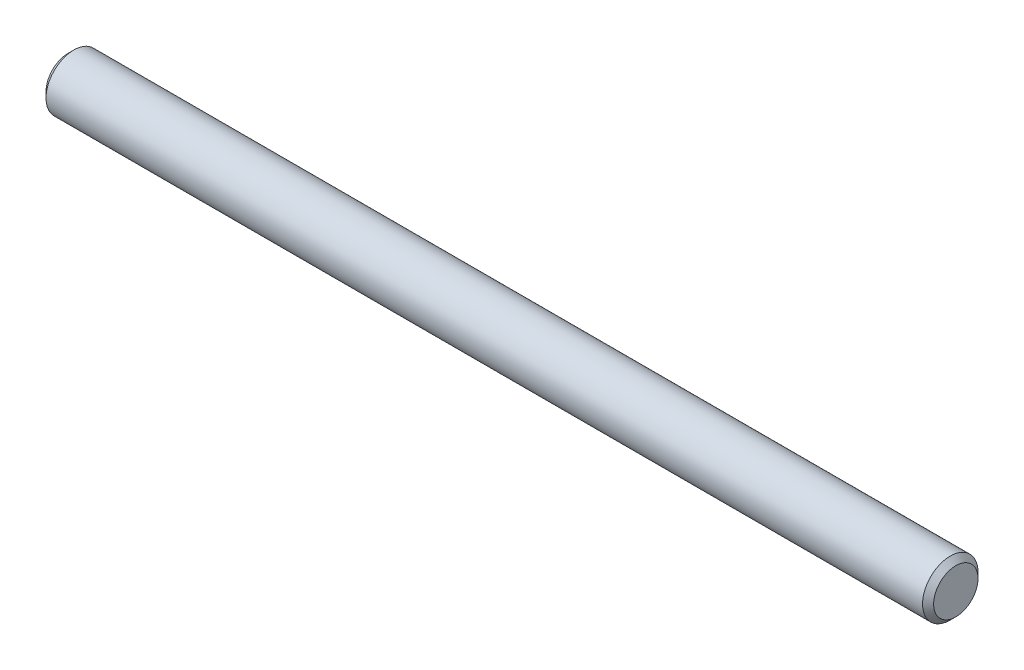
from build123d import *

# Parameters (mm, degrees)
EXTRUDE1_DEPTH      = 152.4
EXTRUDE1_DEPTH_BACK = 152.4
SKETCH2_R           = 9.525
CHAMFER1_SIZE       = 1.905


with BuildPart() as part:
    # Sketch2 → Extrude1 (new, two sides: drawn at the far end of the back side and taken through both)
    with BuildSketch(Plane(origin=(0, 0, 0), x_dir=(0, 0, -1), z_dir=(1, 0, 0)).offset(-EXTRUDE1_DEPTH_BACK)):
        Circle(SKETCH2_R)
    extrude(amount=EXTRUDE1_DEPTH + EXTRUDE1_DEPTH_BACK)

    # Chamfer1
    chamfer1_edges = [part.edges().sort_by_distance(p)[0] for p in [
        (-152.4, 0, 9.525),
        (152.4, 0, 9.525),
    ]]
    chamfer(chamfer1_edges, length=CHAMFER1_SIZE)


solid = part.part
